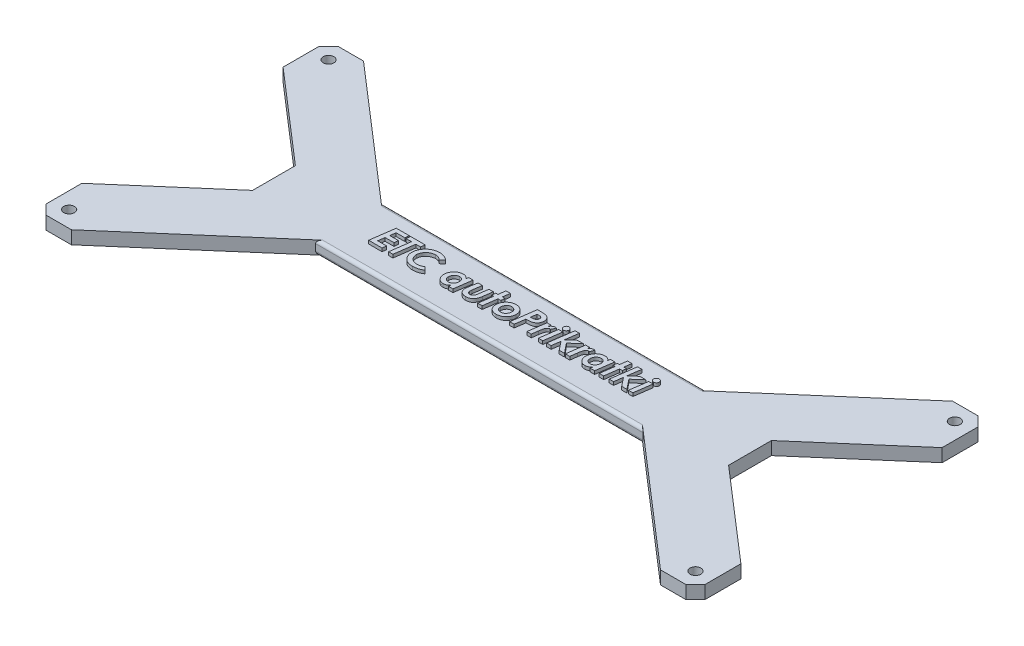
from build123d import *

# Parameters (mm, degrees)
SKETCH1_R           = 1.65
BOSS_EXTRUDE1_DEPTH = 4
BOSS_EXTRUDE2_DEPTH = 1
FILLET1_R           = 1


with BuildPart() as part:
    # Sketch1 → Boss-Extrude1 (new body)
    # profile 1 of 2: a face of its own
    with BuildSketch(Plane(origin=(0, 0, 0), x_dir=(1, 0, 0), z_dir=(0, 1, 0))):
        Polygon((0, 10), (0, -10), (50, -10), (90.01956326, -44.641426316), (97.773936856, -44.641426316), (100.702869044, -41.712494128), (100.702869044, -30.743435286), (72.747301092, -6.544751732), (72.747301092, 6.544751732), (100.702869044, 30.743435286), (100.702869044, 41.712494128), (97.773936856, 44.641426316), (90.01956326, 44.641426316), (50, 10), align=None)
        with Locations(Location((95.702869044, -39.641426316, 0), (0, 0, 270))):
            Circle(SKETCH1_R, mode=Mode.SUBTRACT)
        with Locations(Location((95.702869044, 39.641426316, 0), (0, 0, 270))):
            Circle(SKETCH1_R, mode=Mode.SUBTRACT)
    # profile 2 of 2: a face of its own
    with BuildSketch(Plane(origin=(0, 0, 0), x_dir=(1, 0, 0), z_dir=(0, 1, 0))):
        Polygon((-100.702869044, -30.743435286), (-100.702869044, -41.712494128), (-97.773936856, -44.641426316), (-90.01956326, -44.641426316), (-50, -10), (0, -10), (0, 10), (-50, 10), (-90.01956326, 44.641426316), (-97.773936856, 44.641426316), (-100.702869044, 41.712494128), (-100.702869044, 30.743435286), (-72.747301092, 6.544751732), (-72.747301092, -6.544751732), align=None)
        with Locations(Location((-95.702869044, -39.641426316, 0), (0, 0, 270))):
            Circle(SKETCH1_R, mode=Mode.SUBTRACT)
        with Locations(Location((-95.702869044, 39.641426316, 0), (0, 0, 270))):
            Circle(SKETCH1_R, mode=Mode.SUBTRACT)
    extrude(amount=BOSS_EXTRUDE1_DEPTH)

    # Sketch2 → Boss-Extrude2 (add)
    # profile 1 of 18: a face of its own
    with BuildSketch(Plane(origin=(0, 4, 0), x_dir=(1, 0, 0), z_dir=(0, 1, 0))):
        Polygon((-39.771213942, 4.408333333), (-35.776175214, 4.408333333), (-35.931999533, 3.173611111), (-38.60178953, 3.173611111), (-38.842204193, 1.463995726), (-36.147185497, 1.463995726), (-36.304493857, 0.229273504), (-39.015837006, 0.229273504), (-39.294836739, -1.765277778), (-36.555296808, -1.765277778), (-36.711121127, -3), (-40.810042735, -3), align=None)
    # profile 2 of 18: a face of its own
    with BuildSketch(Plane(origin=(0, 4, 0), x_dir=(1, 0, 0), z_dir=(0, 1, 0))):
        Polygon((-35.396260684, 4.408333333), (-30.932264957, 4.408333333), (-31.0925414, 3.173611111), (-32.53502938, 3.173611111), (-33.391321114, -3), (-34.731410256, -3), (-33.876602564, 3.173611111), (-35.566925414, 3.173611111), align=None)
    # profile 3 of 18: a face of its own
    with BuildSketch(Plane(origin=(0, 4, 0), x_dir=(1, 0, 0), z_dir=(0, 1, 0))):
        with BuildLine():
            Line((-23.79402711, 3.476355502), (-24.819499533, 2.557734041))
            add(Edge.make_bspline(
                [(-24.819499533, 2.557734041), (-24.876407481, 2.620086184), (-24.98999964, 2.744545327), (-25.186822346, 2.904370451), (-25.400073268, 3.04348227), (-25.63072019, 3.158974908), (-25.875271556, 3.251218503), (-26.131628235, 3.31621634), (-26.398268359, 3.355898248), (-26.579434113, 3.360982371), (-26.671582866, 3.363568376)],
                knots=[0, 0, 0, 0, 0.971056601, 1.938295404, 2.910103745, 3.898650509, 4.902833105, 5.914277838, 6.939111328, 8, 8, 8, 8], degree=3))
            add(Edge.make_bspline(
                [(-26.671582866, 3.363568376), (-26.736927778, 3.36254447), (-26.866918827, 3.360507607), (-27.060824218, 3.340473973), (-27.252528939, 3.307554749), (-27.442345152, 3.26300068), (-27.63073036, 3.206945518), (-27.815626073, 3.135056734), (-27.998755299, 3.05144716), (-28.179261883, 2.957425539), (-28.352728039, 2.8510152), (-28.517844342, 2.73671784), (-28.673028959, 2.614912938), (-28.817491352, 2.483633182), (-28.952140004, 2.343787212), (-29.079417358, 2.197548374), (-29.192971729, 2.040379018), (-29.298745976, 1.878102834), (-29.391700967, 1.709081018), (-29.472937414, 1.536934578), (-29.544662435, 1.362891714), (-29.597572089, 1.184235022), (-29.644038608, 1.003997543), (-29.673831242, 0.820179886), (-29.694641334, 0.633906077), (-29.696572065, 0.508826803), (-29.697542735, 0.44594351)],
                knots=[0, 0, 0, 0, 1.01063672, 2.010466049, 3.011934156, 4.018040672, 5.025194429, 6.049901815, 7.084166442, 8.138480354, 9.196343408, 10.230183256, 11.243713301, 12.245999792, 13.247233952, 14.245803109, 15.242258641, 16.244194478, 17.240973215, 18.223430354, 19.188354289, 20.149355445, 21.103383867, 22.065846529, 23.027609163, 24, 24, 24, 24], degree=3))
            add(Edge.make_bspline(
                [(-29.697542735, 0.44594351), (-29.695906406, 0.361713694), (-29.692686925, 0.195991369), (-29.656556235, -0.046797151), (-29.6027796, -0.279278505), (-29.524945333, -0.500678356), (-29.424565133, -0.710510256), (-29.304634424, -0.911254961), (-29.158702456, -1.098087769), (-28.995248001, -1.274456475), (-28.813339237, -1.43349079), (-28.618391937, -1.574673546), (-28.409164688, -1.691626287), (-28.188439911, -1.789360361), (-27.954237879, -1.862966302), (-27.708364354, -1.916096732), (-27.45016546, -1.950032576), (-27.273716941, -1.953475965), (-27.183577057, -1.955235043)],
                knots=[0, 0, 0, 0, 1.037508871, 2.041300697, 3.018951676, 3.975513831, 4.927438979, 5.88223082, 6.851861871, 7.844178858, 8.842305637, 9.825493826, 10.805727671, 11.791408773, 12.796144752, 13.825955475, 14.88937509, 16, 16, 16, 16], degree=3))
            add(Edge.make_bspline(
                [(-27.183577057, -1.955235043), (-27.086557399, -1.953579506), (-26.895603749, -1.950321087), (-26.61445757, -1.922961614), (-26.343228538, -1.878542935), (-26.082111473, -1.81677731), (-25.830845657, -1.735617672), (-25.589368507, -1.638358716), (-25.357393357, -1.522355311), (-25.211587272, -1.431075621), (-25.138568376, -1.385363248)],
                knots=[0, 0, 0, 0, 1.080949117, 2.127519159, 3.144326023, 4.141762213, 5.114520833, 6.083915527, 7.040435296, 8, 8, 8, 8], degree=3))
            Line((-25.138568376, -1.385363248), (-24.306021301, -2.302500668))
            add(Edge.make_bspline(
                [(-24.306021301, -2.302500668), (-24.412286815, -2.373503026), (-24.624235436, -2.5151186), (-24.96050339, -2.695733979), (-25.309380822, -2.847347024), (-25.669592348, -2.972240909), (-26.041988615, -3.070964071), (-26.427116952, -3.139950836), (-26.824941671, -3.182910909), (-27.094424321, -3.187586494), (-27.231066373, -3.189957265)],
                knots=[0, 0, 0, 0, 0.987115275, 1.968820479, 2.944554184, 3.923725951, 4.912076401, 5.918257257, 6.944445583, 8, 8, 8, 8], degree=3))
            add(Edge.make_bspline(
                [(-27.231066373, -3.189957265), (-27.326579867, -3.188480901), (-27.514372054, -3.185578173), (-27.790270637, -3.164273172), (-28.05553042, -3.130936514), (-28.309640805, -3.081554084), (-28.553097807, -3.019593403), (-28.78595887, -2.944064118), (-29.007303301, -2.853004619), (-29.218464758, -2.74959823), (-29.418316633, -2.631164277), (-29.608694989, -2.500863787), (-29.788175531, -2.356355286), (-29.95826823, -2.200201027), (-30.117401377, -2.030476567), (-30.26598075, -1.846995018), (-30.405318147, -1.651257468), (-30.534055296, -1.444282919), (-30.649646994, -1.228154887), (-30.749809799, -1.00571883), (-30.837543489, -0.780002075), (-30.904663438, -0.548101727), (-30.960532833, -0.313085231), (-30.99844473, -0.072449284), (-31.02341294, 0.171853502), (-31.025963384, 0.336557107), (-31.02724359, 0.419230769)],
                knots=[0, 0, 0, 0, 1.169367826, 2.299132101, 3.38621766, 4.441052208, 5.466435492, 6.460518735, 7.435693363, 8.394593391, 9.33676259, 10.277587488, 11.216890426, 12.155626877, 13.10261201, 14.062754619, 15.044266364, 16.042621295, 17.045211417, 18.042739217, 19.028130471, 20.007415779, 20.996189116, 21.983978755, 22.988049715, 24, 24, 24, 24], degree=3))
            add(Edge.make_bspline(
                [(-31.02724359, 0.419230769), (-31.025687458, 0.508353994), (-31.022584602, 0.686061646), (-30.992660926, 0.951246499), (-30.947392339, 1.213639829), (-30.882588781, 1.47323009), (-30.801859185, 1.730114895), (-30.699289737, 1.983202364), (-30.581145405, 2.234638595), (-30.442880031, 2.480647261), (-30.291984873, 2.720172859), (-30.124506199, 2.946639304), (-29.944540302, 3.160226591), (-29.753688143, 3.362944653), (-29.54779556, 3.550294852), (-29.328761867, 3.724230948), (-29.097397481, 3.885959841), (-28.854062157, 4.034175936), (-28.602161976, 4.16740583), (-28.342330811, 4.281621357), (-28.07758032, 4.380449582), (-27.806841171, 4.460383651), (-27.529957591, 4.521163389), (-27.248056659, 4.565770492), (-26.96003137, 4.593203378), (-26.766126043, 4.596588357), (-26.668614784, 4.598290598)],
                knots=[0, 0, 0, 0, 0.95794203, 1.910092795, 2.865876462, 3.819215003, 4.78477586, 5.758651491, 6.753180615, 7.769892659, 8.790977917, 9.795230985, 10.79565955, 11.792688852, 12.786634645, 13.785945562, 14.798181656, 15.819862441, 16.847685968, 17.859754353, 18.869513914, 19.884373831, 20.892254455, 21.915374149, 22.951681752, 24, 24, 24, 24], degree=3))
            add(Edge.make_bspline(
                [(-26.668614784, 4.598290598), (-26.532413822, 4.594825119), (-26.263460168, 4.587981899), (-25.867359044, 4.534959759), (-25.485083229, 4.447563163), (-25.117151488, 4.323316156), (-24.762211581, 4.166010168), (-24.42261631, 3.971542635), (-24.09693314, 3.742523662), (-23.895859801, 3.565837444), (-23.79402711, 3.476355502)],
                knots=[0, 0, 0, 0, 1.033545388, 2.040923972, 3.027343848, 4.005734438, 4.983995331, 5.969464303, 6.971644303, 8, 8, 8, 8], degree=3))
        make_face()
    # profile 4 of 18: a face of its own
    with BuildSketch(Plane(origin=(0, 4, 0), x_dir=(1, 0, 0), z_dir=(0, 1, 0))):
        with BuildLine():
            Line((-15.631800881, 2.413782051), (-14.290227698, 2.413782051))
            Line((-14.290227698, 2.413782051), (-15.058961004, -3))
            Line((-15.058961004, -3), (-16.400534188, -3))
            Line((-16.400534188, -3), (-16.307039597, -2.338117655))
            add(Edge.make_bspline(
                [(-16.307039597, -2.338117655), (-16.3767978, -2.404517982), (-16.50981432, -2.531131627), (-16.715833278, -2.695391946), (-16.914150652, -2.828981498), (-17.109669225, -2.931442959), (-17.307759346, -3.005780404), (-17.513377505, -3.057268876), (-17.73070468, -3.089470654), (-17.879513004, -3.093111775), (-17.955809295, -3.094978632)],
                knots=[0, 0, 0, 0, 1.236324186, 2.357450916, 3.379388742, 4.30284698, 5.185433758, 6.089881904, 7.020653398, 8, 8, 8, 8], degree=3))
            add(Edge.make_bspline(
                [(-17.955809295, -3.094978632), (-18.043017702, -3.092946993), (-18.213810767, -3.088968134), (-18.462950707, -3.050464447), (-18.698476746, -2.990245504), (-18.920499797, -2.905274734), (-19.127820194, -2.794363737), (-19.322422815, -2.659913044), (-19.502547887, -2.50026755), (-19.665725068, -2.317538955), (-19.812885936, -2.120592428), (-19.940886217, -1.91247752), (-20.052031255, -1.698063475), (-20.138540489, -1.473433178), (-20.209953015, -1.242787664), (-20.257759224, -1.003050803), (-20.288597701, -0.755943865), (-20.292622347, -0.588526805), (-20.29465812, -0.503842815)],
                knots=[0, 0, 0, 0, 1.072254913, 2.099954687, 3.093402483, 4.05863531, 5.017013142, 5.979305845, 6.962352722, 7.970695896, 8.988290287, 9.983079422, 10.973839091, 11.95483031, 12.940586347, 13.940815436, 14.958409826, 16, 16, 16, 16], degree=3))
            add(Edge.make_bspline(
                [(-20.29465812, -0.503842815), (-20.293636647, -0.438497408), (-20.291604624, -0.308505374), (-20.271534968, -0.114607312), (-20.238833948, 0.076650357), (-20.193921774, 0.265902297), (-20.137939291, 0.453096619), (-20.067957344, 0.637560559), (-19.984012099, 0.818922692), (-19.889653732, 0.997400114), (-19.785502182, 1.170840222), (-19.668667464, 1.333628842), (-19.546022653, 1.488741044), (-19.413633743, 1.633135499), (-19.271834386, 1.766340825), (-19.123547639, 1.892557415), (-18.963998601, 2.005670403), (-18.798805481, 2.111587543), (-18.627008729, 2.203812315), (-18.453264172, 2.286689478), (-18.276229765, 2.35425155), (-18.098138067, 2.411443266), (-17.917436658, 2.454391557), (-17.735007852, 2.485262944), (-17.55063722, 2.505750612), (-17.427049763, 2.507756298), (-17.365160924, 2.508760684)],
                knots=[0, 0, 0, 0, 1.010861959, 2.01091412, 3.012605424, 4.011485121, 5.018863341, 6.033918867, 7.061452407, 8.109228878, 9.15680961, 10.18900835, 11.207521355, 12.215190347, 13.216881651, 14.216552911, 15.225616441, 16.240671966, 17.251099115, 18.240697123, 19.217272556, 20.180771028, 21.133199006, 22.08832996, 23.042693801, 24, 24, 24, 24], degree=3))
            add(Edge.make_bspline(
                [(-17.365160924, 2.508760684), (-17.282856652, 2.506415814), (-17.120623119, 2.50179374), (-16.883008381, 2.458465319), (-16.655377909, 2.389936588), (-16.438295162, 2.29490488), (-16.234427982, 2.173813461), (-16.049729642, 2.024653892), (-15.880026831, 1.853682677), (-15.787265906, 1.721243011), (-15.740135884, 1.653952991)],
                knots=[0, 0, 0, 0, 1.030509072, 2.031281277, 3.015697838, 4.003854478, 4.993584726, 5.977161716, 6.972235198, 8, 8, 8, 8], degree=3))
            Line((-15.740135884, 1.653952991), (-15.631800881, 2.413782051))
        make_face()
        with BuildLine():
            add(Edge.make_bspline(
                [(-17.657517027, -1.86025641), (-17.580155556, -1.857865279), (-17.429286253, -1.853202126), (-17.211320514, -1.811894144), (-17.008206777, -1.746844709), (-16.820251954, -1.653856402), (-16.646809674, -1.531557478), (-16.489374584, -1.37891922), (-16.347177448, -1.196069227), (-16.222472975, -0.988516416), (-16.118253729, -0.765295188), (-16.041893969, -0.534844175), (-15.993197295, -0.301586622), (-15.987729997, -0.144441486), (-15.985002671, -0.066050681)],
                knots=[0, 0, 0, 0, 1.017901168, 1.985097214, 2.910041334, 3.818973104, 4.735274743, 5.693545178, 6.695670165, 7.777101795, 8.875856117, 9.932619244, 10.968700869, 12, 12, 12, 12], degree=3))
            add(Edge.make_bspline(
                [(-15.985002671, -0.066050681), (-15.986250308, -0.017037192), (-15.98870219, 0.079285085), (-16.004729489, 0.21994386), (-16.032904443, 0.353189526), (-16.073330641, 0.478939768), (-16.124969038, 0.597329823), (-16.188202338, 0.708706764), (-16.262127624, 0.812290736), (-16.347099014, 0.907993263), (-16.44205478, 0.992781722), (-16.542734272, 1.070513624), (-16.653817999, 1.131552493), (-16.769921411, 1.184816317), (-16.894217235, 1.224105488), (-17.025013891, 1.254717817), (-17.163945769, 1.270277357), (-17.258773246, 1.272765582), (-17.30728332, 1.274038462)],
                knots=[0, 0, 0, 0, 1.109141645, 2.179707075, 3.198451464, 4.18615572, 5.163657463, 6.116161664, 7.079133258, 8.038519567, 9.005387219, 9.956904198, 10.909408399, 11.866440704, 12.843493655, 13.853714903, 14.902043453, 16, 16, 16, 16], degree=3))
            add(Edge.make_bspline(
                [(-17.30728332, 1.274038462), (-17.363773345, 1.272805392), (-17.47529198, 1.270371153), (-17.639167277, 1.245230146), (-17.797225455, 1.207691537), (-17.947936187, 1.151516704), (-18.092871967, 1.082280036), (-18.229779144, 0.994804137), (-18.361319503, 0.893443602), (-18.484700261, 0.777236128), (-18.597238889, 0.648656004), (-18.695734232, 0.509945008), (-18.779552694, 0.361894113), (-18.847850719, 0.204734826), (-18.899560681, 0.037793641), (-18.93846921, -0.136772253), (-18.960878796, -0.321217081), (-18.963575885, -0.44689433), (-18.964957265, -0.511263021)],
                knots=[0, 0, 0, 0, 0.994897251, 1.964056203, 2.915642991, 3.853470011, 4.79324038, 5.741466074, 6.711095529, 7.716481674, 8.723680824, 9.71796663, 10.70964959, 11.717112863, 12.731868792, 13.785363818, 14.865719672, 16, 16, 16, 16], degree=3))
            add(Edge.make_bspline(
                [(-18.964957265, -0.511263021), (-18.96368736, -0.560763654), (-18.961203954, -0.657566255), (-18.945587666, -0.799419583), (-18.915176502, -0.933270624), (-18.875242893, -1.059991117), (-18.824865578, -1.179703092), (-18.762119277, -1.291674715), (-18.687415413, -1.396115058), (-18.601829857, -1.49217523), (-18.506527631, -1.577691272), (-18.405532804, -1.654530518), (-18.296678053, -1.71815041), (-18.181449258, -1.770758895), (-18.059424431, -1.810735674), (-17.931036114, -1.83831901), (-17.796580952, -1.857184913), (-17.704579069, -1.859216954), (-17.657517027, -1.86025641)],
                knots=[0, 0, 0, 0, 1.124431694, 2.198919568, 3.234766021, 4.236791382, 5.213425507, 6.179206721, 7.145706547, 8.12447102, 9.094881178, 10.04988442, 11.001776355, 11.952075609, 12.922030374, 13.911569148, 14.931697721, 16, 16, 16, 16], degree=3))
        make_face(mode=Mode.SUBTRACT)
    # profile 5 of 18: a face of its own
    with BuildSketch(Plane(origin=(0, 4, 0), x_dir=(1, 0, 0), z_dir=(0, 1, 0))):
        with BuildLine():
            Line((-12.792830195, 2.413782051), (-11.451257011, 2.413782051))
            Line((-11.451257011, 2.413782051), (-11.846011952, -0.334662126))
            add(Edge.make_bspline(
                [(-11.846011952, -0.334662126), (-11.85517241, -0.405863674), (-11.872265806, -0.538725619), (-11.892285446, -0.723689151), (-11.902907773, -0.880671786), (-11.905626713, -0.97575758), (-11.906857639, -1.018805088)],
                knots=[0, 0, 0, 0, 1.253526504, 2.339077935, 3.248062684, 4, 4, 4, 4], degree=3))
            add(Edge.make_bspline(
                [(-11.906857639, -1.018805088), (-11.904468498, -1.076086334), (-11.899787682, -1.18831206), (-11.849247524, -1.347779577), (-11.772675564, -1.494660652), (-11.664075632, -1.622249934), (-11.531718332, -1.729072989), (-11.377121942, -1.805147159), (-11.204764624, -1.853027366), (-11.083542568, -1.857793093), (-11.020885083, -1.86025641)],
                knots=[0, 0, 0, 0, 1.002835694, 1.964761131, 2.909147679, 3.895784594, 4.884866332, 5.875587295, 6.90192956, 8, 8, 8, 8], degree=3))
            add(Edge.make_bspline(
                [(-11.020885083, -1.86025641), (-10.979781535, -1.859554891), (-10.899759813, -1.858189152), (-10.783393802, -1.843168127), (-10.674655916, -1.817833153), (-10.573176943, -1.783711131), (-10.478676165, -1.740750813), (-10.391812616, -1.686958443), (-10.313257104, -1.622459077), (-10.239132201, -1.54832536), (-10.173740996, -1.456453922), (-10.111049684, -1.348094121), (-10.055736003, -1.218428414), (-10.001768544, -1.070196924), (-9.955639637, -0.900610146), (-9.912550359, -0.711493818), (-9.874246899, -0.50249978), (-9.853406326, -0.356014798), (-9.842556424, -0.279752604)],
                knots=[0, 0, 0, 0, 0.892108868, 1.736786517, 2.541881516, 3.312938247, 4.057891121, 4.791136306, 5.524224126, 6.261001152, 7.060198994, 7.964829526, 8.974738879, 10.116351085, 11.388184609, 12.787440625, 14.327495265, 16, 16, 16, 16], degree=3))
            Line((-9.842556424, -0.279752604), (-9.45818977, 2.413782051))
            Line((-9.45818977, 2.413782051), (-8.115132545, 2.413782051))
            Line((-8.115132545, 2.413782051), (-8.529180021, -0.48455028))
            add(Edge.make_bspline(
                [(-8.529180021, -0.48455028), (-8.54098436, -0.563296158), (-8.563993425, -0.716787934), (-8.606996582, -0.939599982), (-8.656456728, -1.148733602), (-8.708275056, -1.34511558), (-8.770380897, -1.52618225), (-8.834413321, -1.695088554), (-8.907827944, -1.849059911), (-9.008839932, -2.035727205), (-9.154760639, -2.244718209), (-9.355267873, -2.467740078), (-9.583578494, -2.658678089), (-9.838151615, -2.816622519), (-10.116596687, -2.942995365), (-10.419960627, -3.030785694), (-10.746331257, -3.085634196), (-10.9716848, -3.091803495), (-11.087666934, -3.094978632)],
                knots=[0, 0, 0, 0, 0.938282912, 1.828904783, 2.673080473, 3.47068305, 4.220973376, 4.927886656, 5.59807994, 6.229421123, 7.427669869, 8.591533972, 9.754419504, 10.92230609, 12.112044702, 13.346047806, 14.63409719, 16, 16, 16, 16], degree=3))
            add(Edge.make_bspline(
                [(-11.087666934, -3.094978632), (-11.169864207, -3.093376064), (-11.330260478, -3.09024888), (-11.564519776, -3.062742152), (-11.785791222, -3.01931032), (-11.993556456, -2.95590713), (-12.189747241, -2.877888345), (-12.371954701, -2.77959091), (-12.542055512, -2.664301172), (-12.696613325, -2.531134048), (-12.83606792, -2.384253515), (-12.958666898, -2.226624664), (-13.061778648, -2.057896373), (-13.145093368, -1.878411186), (-13.210287597, -1.689349531), (-13.258302051, -1.490229518), (-13.286893103, -1.280339118), (-13.289922711, -1.13662847), (-13.291468015, -1.063326322)],
                knots=[0, 0, 0, 0, 1.168632583, 2.280420012, 3.349725486, 4.371307417, 5.365511249, 6.347568045, 7.309587773, 8.282530155, 9.242979364, 10.185822766, 11.117310968, 12.048958566, 12.994554036, 13.956959565, 14.957911239, 16, 16, 16, 16], degree=3))
            add(Edge.make_bspline(
                [(-13.291468015, -1.063326322), (-13.290611556, -1.015340428), (-13.288845168, -0.916372868), (-13.283474477, -0.762893737), (-13.270868455, -0.599664101), (-13.254448686, -0.426022132), (-13.234298414, -0.242308549), (-13.206169244, -0.049191581), (-13.177859578, 0.154001058), (-13.153857916, 0.292161307), (-13.141579861, 0.362837206)],
                knots=[0, 0, 0, 0, 0.80233306, 1.654755999, 2.566827454, 3.538651181, 4.570611162, 5.655930814, 6.800891005, 8, 8, 8, 8], degree=3))
            Line((-13.141579861, 0.362837206), (-12.792830195, 2.413782051))
        make_face()
    # profile 6 of 18: a face of its own
    with BuildSketch(Plane(origin=(0, 4, 0), x_dir=(1, 0, 0), z_dir=(0, 1, 0))):
        Polygon((-6.418873531, 4.598290598), (-5.078784388, 4.598290598), (-5.381528779, 2.413782051), (-4.534141293, 2.413782051), (-4.694417735, 1.274038462), (-5.540321181, 1.274038462), (-6.132453592, -3), (-7.472542735, -3), (-6.880410323, 1.274038462), (-7.536356504, 1.274038462), (-7.382016226, 2.413782051), (-6.721617922, 2.413782051), align=None)
    # profile 7 of 18: a face of its own
    with BuildSketch(Plane(origin=(0, 4, 0), x_dir=(1, 0, 0), z_dir=(0, 1, 0))):
        with BuildLine():
            add(Edge.make_bspline(
                [(-1.215825321, 2.508760684), (-1.155921969, 2.508208528), (-1.03736522, 2.507115738), (-0.86160791, 2.489178261), (-0.689502349, 2.46485436), (-0.521875247, 2.429286064), (-0.358874749, 2.382813875), (-0.199810805, 2.326203904), (-0.044290303, 2.260026162), (0.105534973, 2.182376254), (0.249533212, 2.096560175), (0.38638478, 2.001915788), (0.513810553, 1.897078145), (0.635383688, 1.786136534), (0.745982597, 1.664059846), (0.848613821, 1.534323318), (0.944517948, 1.397000306), (1.031435869, 1.251244799), (1.10797829, 1.09794926), (1.177100328, 0.941047495), (1.233578197, 0.7781215), (1.278556237, 0.610725743), (1.317303133, 0.439239602), (1.34069961, 0.262885063), (1.358918086, 0.082236703), (1.359947828, -0.039782676), (1.360470085, -0.101667668)],
                knots=[0, 0, 0, 0, 1.048380346, 2.074885017, 3.090367486, 4.090964834, 5.072523792, 6.056029873, 7.045505985, 8.029469653, 9.008388104, 9.979110116, 10.939576094, 11.895736256, 12.858269977, 13.820062943, 14.790784955, 15.789017664, 16.788414625, 17.789274365, 18.789121639, 19.804049856, 20.823403653, 21.864603227, 22.916983403, 24, 24, 24, 24], degree=3))
            add(Edge.make_bspline(
                [(1.360470085, -0.101667668), (1.357437506, -0.203704076), (1.351464579, -0.404673597), (1.309585453, -0.700315364), (1.238011038, -0.983731182), (1.137810107, -1.255740957), (1.009637454, -1.516415738), (0.852961015, -1.765989133), (0.665952093, -2.001860605), (0.455100485, -2.224577019), (0.223732363, -2.42860321), (-0.024354719, -2.607065681), (-0.285975769, -2.757929902), (-0.560478517, -2.882401605), (-0.849863873, -2.977017043), (-1.15198606, -3.044783368), (-1.467352402, -3.08814412), (-1.682164848, -3.092671486), (-1.79163328, -3.094978632)],
                knots=[0, 0, 0, 0, 1.011104245, 1.991457176, 2.952197104, 3.902991464, 4.858928698, 5.826026836, 6.817568841, 7.837123857, 8.861887107, 9.870051414, 10.860623363, 11.850212162, 12.851715058, 13.872153699, 14.915649431, 16, 16, 16, 16], degree=3))
            add(Edge.make_bspline(
                [(-1.79163328, -3.094978632), (-1.88622503, -3.093237668), (-2.071055225, -3.089835862), (-2.340558096, -3.055892579), (-2.595794318, -3.003657965), (-2.83605884, -2.926999327), (-3.062308455, -2.831218149), (-3.27361908, -2.712552257), (-3.470528769, -2.573215972), (-3.64903777, -2.410727812), (-3.8115363, -2.233027296), (-3.952387721, -2.039686134), (-4.072854067, -1.833253209), (-4.168563075, -1.612583273), (-4.244821934, -1.379597858), (-4.299576006, -1.133676206), (-4.332931295, -0.874291356), (-4.336450322, -0.696869737), (-4.338247863, -0.606241653)],
                knots=[0, 0, 0, 0, 1.130534475, 2.209039425, 3.242686211, 4.241648197, 5.219495055, 6.175504508, 7.134035888, 8.097337106, 9.056251676, 10.008649417, 10.952170628, 11.908308165, 12.879116703, 13.879338768, 14.916752852, 16, 16, 16, 16], degree=3))
            add(Edge.make_bspline(
                [(-4.338247863, -0.606241653), (-4.335316767, -0.49678692), (-4.329550657, -0.281465397), (-4.286435348, 0.03457729), (-4.211741365, 0.335720952), (-4.108566761, 0.622504415), (-3.978272887, 0.896278228), (-3.814264225, 1.153570206), (-3.623973769, 1.39857346), (-3.404974947, 1.624535916), (-3.167844887, 1.830668018), (-2.91894582, 2.013010946), (-2.65800731, 2.164674737), (-2.389399121, 2.292766189), (-2.108599945, 2.388468817), (-1.819667169, 2.458743752), (-1.520848697, 2.501649469), (-1.31836503, 2.506370107), (-1.215825321, 2.508760684)],
                knots=[0, 0, 0, 0, 1.070407058, 2.105725986, 3.11260329, 4.099768105, 5.082273654, 6.071629737, 7.078227986, 8.111679688, 9.144009435, 10.148605521, 11.124500349, 12.092034995, 13.054511379, 14.020338642, 14.997480131, 16, 16, 16, 16], degree=3))
        make_face()
        with BuildLine():
            add(Edge.make_bspline(
                [(-1.313772035, 1.274038462), (-1.38015258, 1.272424057), (-1.509521237, 1.269277754), (-1.697584111, 1.242057457), (-1.873806966, 1.197713921), (-2.038851803, 1.135633825), (-2.190519864, 1.052806841), (-2.332149644, 0.954598618), (-2.459628187, 0.836145174), (-2.574497555, 0.702982308), (-2.675749972, 0.559386553), (-2.764733303, 0.411654975), (-2.840048657, 0.260382986), (-2.899919979, 0.105953235), (-2.950530059, -0.050624394), (-2.984157386, -0.210787919), (-3.00365505, -0.374248122), (-3.006904936, -0.484003568), (-3.008547009, -0.539459802)],
                knots=[0, 0, 0, 0, 1.147646984, 2.236642535, 3.278363253, 4.285788599, 5.277283386, 6.259990092, 7.25913394, 8.278119336, 9.296601724, 10.294389209, 11.258634566, 12.215104854, 13.156804447, 14.101569642, 15.040778374, 16, 16, 16, 16], degree=3))
            add(Edge.make_bspline(
                [(-3.008547009, -0.539459802), (-3.007313247, -0.587978147), (-3.00490149, -0.682821792), (-2.988807255, -0.8215315), (-2.960230158, -0.952494423), (-2.922148481, -1.076663222), (-2.870925491, -1.193371852), (-2.809118402, -1.303069771), (-2.734933613, -1.404674932), (-2.652902307, -1.500050011), (-2.558824526, -1.584101012), (-2.458131527, -1.658441295), (-2.350064578, -1.722059733), (-2.233497292, -1.771826487), (-2.110018843, -1.812460381), (-1.979151506, -1.840216134), (-1.841031703, -1.856740841), (-1.746664585, -1.859062537), (-1.698138689, -1.86025641)],
                knots=[0, 0, 0, 0, 1.110133544, 2.170088686, 3.189065258, 4.17351184, 5.136579884, 6.099647928, 7.048308506, 8.010844321, 8.972448026, 9.927769731, 10.871216919, 11.834284962, 12.822174017, 13.841150589, 14.889866456, 16, 16, 16, 16], degree=3))
            add(Edge.make_bspline(
                [(-1.698138689, -1.86025641), (-1.629797401, -1.858496409), (-1.496589791, -1.855065899), (-1.303077382, -1.829917401), (-1.122302632, -1.787212392), (-0.9543182, -1.726071697), (-0.799300264, -1.6466474), (-0.655342615, -1.551748726), (-0.52570715, -1.437416989), (-0.408977049, -1.308423837), (-0.306408798, -1.168335222), (-0.216867179, -1.021480586), (-0.139245566, -0.870667173), (-0.07661943, -0.714159881), (-0.02924048, -0.553017796), (0.005007466, -0.387261927), (0.026264006, -0.216488139), (0.029257862, -0.10073892), (0.030769231, -0.042306023)],
                knots=[0, 0, 0, 0, 1.164111062, 2.269030304, 3.317651816, 4.322802953, 5.30652745, 6.278887004, 7.252451034, 8.242831511, 9.237327035, 10.205734188, 11.170614506, 12.123681709, 13.072978069, 14.028315502, 15.004647829, 16, 16, 16, 16], degree=3))
            add(Edge.make_bspline(
                [(0.030769231, -0.042306023), (0.029654594, 0.005235886), (0.02746365, 0.098684893), (0.009487569, 0.235406498), (-0.020550259, 0.3648467), (-0.060059314, 0.488329359), (-0.114333119, 0.603532051), (-0.177740719, 0.713604605), (-0.256342864, 0.814154201), (-0.343217564, 0.908972866), (-0.439195197, 0.995168865), (-0.544180762, 1.069466637), (-0.654932034, 1.133885444), (-0.773959433, 1.184260567), (-0.899155145, 1.224286915), (-1.031065339, 1.25451487), (-1.170422929, 1.270317131), (-1.26525805, 1.272779043), (-1.313772035, 1.274038462)],
                knots=[0, 0, 0, 0, 1.079193067, 2.121276228, 3.123935011, 4.093589047, 5.058482656, 6.010079462, 6.971567708, 7.949254825, 8.927715837, 9.893916005, 10.864935156, 11.830939453, 12.821955205, 13.846519011, 14.898362312, 16, 16, 16, 16], degree=3))
        make_face(mode=Mode.SUBTRACT)
    # profile 8 of 18: a face of its own
    with BuildSketch(Plane(origin=(0, 4, 0), x_dir=(1, 0, 0), z_dir=(0, 1, 0))):
        with BuildLine():
            Line((3.349085203, 4.408333333), (4.61645633, 4.408333333))
            add(Edge.make_bspline(
                [(4.61645633, 4.408333333), (4.708974201, 4.407956531), (4.887148608, 4.407230872), (5.143968586, 4.396352243), (5.380084768, 4.38056952), (5.594914294, 4.358466311), (5.788414203, 4.331558563), (5.960017865, 4.295028313), (6.11188674, 4.256078866), (6.203199302, 4.219275538), (6.245933494, 4.202051616)],
                knots=[0, 0, 0, 0, 1.344208059, 2.588726621, 3.734329264, 4.782131975, 5.726482068, 6.570895881, 7.331180631, 8, 8, 8, 8], degree=3))
            add(Edge.make_bspline(
                [(6.245933494, 4.202051616), (6.293757118, 4.180473016), (6.388020822, 4.137940088), (6.521206425, 4.063538276), (6.645199285, 3.982604201), (6.761164195, 3.896926023), (6.868252649, 3.804622801), (6.967087669, 3.706437492), (7.055902321, 3.600775621), (7.136454309, 3.489255066), (7.207331135, 3.371856042), (7.270305552, 3.250267346), (7.321840386, 3.123307386), (7.365754587, 2.992233572), (7.39789856, 2.854989123), (7.421205662, 2.713179907), (7.437101028, 2.566501168), (7.438427591, 2.467250323), (7.439102564, 2.416750134)],
                knots=[0, 0, 0, 0, 1.101151138, 2.170445781, 3.198860437, 4.208379212, 5.195204417, 6.164605257, 7.130047863, 8.089887807, 9.049952485, 10.006809717, 10.961522665, 11.923831799, 12.906274987, 13.917075149, 14.940179313, 16, 16, 16, 16], degree=3))
            add(Edge.make_bspline(
                [(7.439102564, 2.416750134), (7.437833751, 2.361310743), (7.435313366, 2.251185248), (7.419105132, 2.088406095), (7.390777169, 1.929626945), (7.35007739, 1.775171926), (7.300328023, 1.623424475), (7.237236044, 1.47654517), (7.164813679, 1.333166003), (7.079693836, 1.196092187), (6.987556425, 1.063996985), (6.884314877, 0.942218591), (6.774294774, 0.829668078), (6.658076308, 0.72388161), (6.531742575, 0.630334325), (6.399720791, 0.54314454), (6.25887862, 0.467477077), (6.10858512, 0.399294714), (5.940740347, 0.340507286), (5.751233475, 0.289410959), (5.536141625, 0.245072871), (5.296319757, 0.208861177), (5.030970904, 0.179194266), (4.740837746, 0.158093424), (4.42518965, 0.141020424), (4.206389996, 0.136596043), (4.09258981, 0.134294872)],
                knots=[0, 0, 0, 0, 0.866399648, 1.721027061, 2.553550129, 3.384204618, 4.21539855, 5.04677222, 5.880012857, 6.723270778, 7.566245156, 8.394738354, 9.214784533, 10.025005932, 10.847562629, 11.668810448, 12.495570546, 13.343317016, 14.245569203, 15.271435576, 16.408570332, 17.675782105, 19.060520395, 20.580184572, 22.221315141, 24, 24, 24, 24], degree=3))
            Line((4.09258981, 0.134294872), (3.651829594, -3))
            Line((3.651829594, -3), (2.31025641, -3))
            Line((2.31025641, -3), (3.349085203, 4.408333333))
        make_face()
        with BuildLine():
            add(Edge.make_bspline(
                [(4.264738582, 1.369017094), (4.356262093, 1.370573249), (4.530479542, 1.373535432), (4.779583993, 1.384343919), (5.003841198, 1.405260719), (5.203669308, 1.432337516), (5.378677187, 1.467932463), (5.529466899, 1.509322601), (5.654791672, 1.561167209), (5.758552038, 1.619603094), (5.840891805, 1.689182954), (5.913869397, 1.76212163), (5.974890092, 1.844067224), (6.023922876, 1.934283035), (6.063138017, 2.031208889), (6.089352949, 2.136630773), (6.105844104, 2.249028588), (6.108199288, 2.326659082), (6.109401709, 2.366292735)],
                knots=[0, 0, 0, 0, 1.839895187, 3.502289619, 5.0101303, 6.365671836, 7.553232357, 8.598057788, 9.502875839, 10.27370316, 10.980290013, 11.662314044, 12.34441055, 13.025273935, 13.721358838, 14.440015487, 15.203561875, 16, 16, 16, 16], degree=3))
            add(Edge.make_bspline(
                [(6.109401709, 2.366292735), (6.107601018, 2.41041882), (6.104090049, 2.496455368), (6.079576298, 2.620154629), (6.034926485, 2.732334659), (5.97618375, 2.834065607), (5.898983514, 2.922911268), (5.805741526, 2.998113914), (5.695484208, 3.05771842), (5.590605255, 3.094456654), (5.493160925, 3.117906312), (5.401745276, 3.131794598), (5.294420125, 3.145358016), (5.170573899, 3.154936639), (5.031105505, 3.164255827), (4.874721277, 3.169899163), (4.702044878, 3.172426432), (4.58133477, 3.173205589), (4.518509615, 3.173611111)],
                knots=[0, 0, 0, 0, 1.03742853, 2.022766538, 2.947121861, 3.864647693, 4.771646501, 5.697975149, 6.666071958, 7.703435297, 8.301453266, 9.020359131, 9.87578453, 10.844509861, 11.939964187, 13.162010635, 14.522931311, 16, 16, 16, 16], degree=3))
            Line((4.518509615, 3.173611111), (4.264738582, 1.369017094))
        make_face(mode=Mode.SUBTRACT)
    # profile 9 of 18: a face of its own
    with BuildSketch(Plane(origin=(0, 4, 0), x_dir=(1, 0, 0), z_dir=(0, 1, 0))):
        with BuildLine():
            Line((8.302814503, 2.413782051), (9.549409054, 2.413782051))
            Line((9.549409054, 2.413782051), (9.452946381, 1.653952991))
            add(Edge.make_bspline(
                [(9.452946381, 1.653952991), (9.497743924, 1.721600093), (9.584072739, 1.851962022), (9.72875452, 2.027002803), (9.880414046, 2.174970441), (10.038680258, 2.297226632), (10.20456082, 2.391726266), (10.377348756, 2.459499382), (10.557076243, 2.501182006), (10.679535924, 2.506225443), (10.741094084, 2.508760684)],
                knots=[0, 0, 0, 0, 1.203274242, 2.318815539, 3.362160423, 4.341361458, 5.27818761, 6.184615762, 7.087440759, 8, 8, 8, 8], degree=3))
            add(Edge.make_bspline(
                [(10.741094084, 2.508760684), (10.771352953, 2.507563731), (10.833356468, 2.505111052), (10.92693753, 2.486226701), (11.022623501, 2.456750163), (11.084686811, 2.428360316), (11.11655649, 2.413782051)],
                knots=[0, 0, 0, 0, 0.929430428, 1.904497954, 2.92395396, 4, 4, 4, 4], degree=3))
            Line((11.11655649, 2.413782051), (10.591205929, 1.208740652))
            add(Edge.make_bspline(
                [(10.591205929, 1.208740652), (10.567040679, 1.218332148), (10.522518724, 1.23600348), (10.45999796, 1.257697405), (10.407153227, 1.270079067), (10.375070633, 1.272842119), (10.361179554, 1.274038462)],
                knots=[0, 0, 0, 0, 1.298729578, 2.392773935, 3.304105365, 4, 4, 4, 4], degree=3))
            add(Edge.make_bspline(
                [(10.361179554, 1.274038462), (10.327917219, 1.272573296), (10.262220787, 1.269679449), (10.165413135, 1.247560076), (10.070912408, 1.213259481), (9.978614245, 1.164296423), (9.890774073, 1.098644517), (9.804490488, 1.021486766), (9.721024738, 0.930006503), (9.639599628, 0.822916399), (9.560601037, 0.694855828), (9.491036468, 0.538360375), (9.423203478, 0.355334932), (9.357494009, 0.144102446), (9.299967615, -0.096800699), (9.243287755, -0.365377956), (9.191609319, -0.662410997), (9.16244462, -0.870308178), (9.147233908, -0.978735978)],
                knots=[0, 0, 0, 0, 0.576935763, 1.139505725, 1.715418098, 2.31853603, 2.945453378, 3.61436612, 4.325438415, 5.091425351, 5.947081821, 6.930670679, 8.058330957, 9.334895625, 10.767784451, 12.355934311, 14.099454639, 16, 16, 16, 16], degree=3))
            Line((9.147233908, -0.978735978), (8.87565438, -3))
            Line((8.87565438, -3), (7.534081197, -3))
            Line((7.534081197, -3), (8.302814503, 2.413782051))
        make_face()
    # profile 10 of 18: a face of its own
    with BuildSketch(Plane(origin=(0, 4, 0), x_dir=(1, 0, 0), z_dir=(0, 1, 0))):
        with BuildLine():
            add(Edge.make_bspline(
                [(12.757905983, 4.693269231), (12.814578641, 4.689964524), (12.925900376, 4.68347311), (13.087332327, 4.63683866), (13.233065104, 4.553426545), (13.364233747, 4.444789302), (13.47287099, 4.313620659), (13.556283104, 4.167887882), (13.602917554, 4.006455932), (13.609408968, 3.895134196), (13.612713675, 3.838461538)],
                knots=[0, 0, 0, 0, 1.014134371, 1.992057583, 2.975098753, 4, 5.024901247, 6.007942417, 6.985865629, 8, 8, 8, 8], degree=3))
            add(Edge.make_bspline(
                [(13.612713675, 3.838461538), (13.609431501, 3.781776075), (13.602984348, 3.670429187), (13.555904201, 3.508761211), (13.473383425, 3.362002945), (13.364106675, 3.230804692), (13.233513366, 3.121709029), (13.086877588, 3.040414281), (12.92595844, 2.993346482), (12.814598229, 2.986923643), (12.757905983, 2.983653846)],
                knots=[0, 0, 0, 0, 1.013694729, 1.991193998, 2.981551723, 4.006008661, 5.030465598, 6.008806002, 6.986305271, 8, 8, 8, 8], degree=3))
            add(Edge.make_bspline(
                [(12.757905983, 2.983653846), (12.701201228, 2.986901278), (12.589816446, 2.993280188), (12.428655664, 3.040792638), (12.281003981, 3.121197043), (12.150374502, 3.230930057), (12.040641488, 3.361559536), (11.960237082, 3.50921122), (11.912724632, 3.670372001), (11.906345723, 3.781756784), (11.903098291, 3.838461538)],
                knots=[0, 0, 0, 0, 1.01324697, 1.990314468, 2.975995575, 4, 5.024004425, 6.009685532, 6.98675303, 8, 8, 8, 8], degree=3))
            add(Edge.make_bspline(
                [(11.903098291, 3.838461538), (11.906368087, 3.895153784), (11.912790927, 4.006513996), (11.959858726, 4.167433144), (12.041153473, 4.314068921), (12.150249136, 4.444662231), (12.281447389, 4.553938981), (12.428205655, 4.636459757), (12.589873631, 4.683539904), (12.70122052, 4.689987057), (12.757905983, 4.693269231)],
                knots=[0, 0, 0, 0, 1.013694729, 1.991193998, 2.969534402, 3.993991339, 5.018448277, 6.008806002, 6.986305271, 8, 8, 8, 8], degree=3))
        make_face()
    # profile 11 of 18: a face of its own
    with BuildSketch(Plane(origin=(0, 4, 0), x_dir=(1, 0, 0), z_dir=(0, 1, 0))):
        Polygon((11.817023905, 2.413782051), (13.158597089, 2.413782051), (12.389863782, -3), (11.048290598, -3), align=None)
    # profile 12 of 18: a face of its own
    with BuildSketch(Plane(origin=(0, 4, 0), x_dir=(1, 0, 0), z_dir=(0, 1, 0))):
        Polygon((14.678255208, 4.598290598), (16.019828392, 4.598290598), (15.449956597, 0.532017895), (17.5498748, 2.413782051), (19.382665598, 2.413782051), (16.628285256, -0.003720954), (19.036884014, -3), (17.434119591, -3), (15.325297142, -0.342082332), (14.954286859, -3), (13.612713675, -3), align=None)
    # profile 13 of 18: a face of its own
    with BuildSketch(Plane(origin=(0, 4, 0), x_dir=(1, 0, 0), z_dir=(0, 1, 0))):
        with BuildLine():
            Line((20.080164931, 2.413782051), (21.326759482, 2.413782051))
            Line((21.326759482, 2.413782051), (21.230296808, 1.653952991))
            add(Edge.make_bspline(
                [(21.230296808, 1.653952991), (21.275094352, 1.721600093), (21.361423167, 1.851962022), (21.506104947, 2.027002803), (21.657764473, 2.174970441), (21.816030686, 2.297226632), (21.981911247, 2.391726266), (22.154699184, 2.459499382), (22.33442667, 2.501182006), (22.456886351, 2.506225443), (22.518444511, 2.508760684)],
                knots=[0, 0, 0, 0, 1.203274242, 2.318815539, 3.362160423, 4.341361458, 5.27818761, 6.184615762, 7.087440759, 8, 8, 8, 8], degree=3))
            add(Edge.make_bspline(
                [(22.518444511, 2.508760684), (22.54870338, 2.507563731), (22.610706895, 2.505111052), (22.704287957, 2.486226701), (22.799973928, 2.456750163), (22.862037238, 2.428360316), (22.893906918, 2.413782051)],
                knots=[0, 0, 0, 0, 0.929430428, 1.904497954, 2.92395396, 4, 4, 4, 4], degree=3))
            Line((22.893906918, 2.413782051), (22.368556357, 1.208740652))
            add(Edge.make_bspline(
                [(22.368556357, 1.208740652), (22.344391107, 1.218332148), (22.299869151, 1.23600348), (22.237348387, 1.257697405), (22.184503654, 1.270079067), (22.152421061, 1.272842119), (22.138529981, 1.274038462)],
                knots=[0, 0, 0, 0, 1.298729578, 2.392773935, 3.304105365, 4, 4, 4, 4], degree=3))
            add(Edge.make_bspline(
                [(22.138529981, 1.274038462), (22.105267646, 1.272573296), (22.039571215, 1.269679449), (21.942763562, 1.247560076), (21.848262836, 1.213259481), (21.755964673, 1.164296423), (21.668124501, 1.098644517), (21.581840916, 1.021486766), (21.498375166, 0.930006503), (21.416950055, 0.822916399), (21.337951464, 0.694855828), (21.268386896, 0.538360375), (21.200553905, 0.355334932), (21.134844436, 0.144102446), (21.077318042, -0.096800699), (21.020638182, -0.365377956), (20.968959747, -0.662410997), (20.939795047, -0.870308178), (20.924584335, -0.978735978)],
                knots=[0, 0, 0, 0, 0.576935763, 1.139505725, 1.715418098, 2.31853603, 2.945453378, 3.61436612, 4.325438415, 5.091425351, 5.947081821, 6.930670679, 8.058330957, 9.334895625, 10.767784451, 12.355934311, 14.099454639, 16, 16, 16, 16], degree=3))
            Line((20.924584335, -0.978735978), (20.653004808, -3))
            Line((20.653004808, -3), (19.311431624, -3))
            Line((19.311431624, -3), (20.080164931, 2.413782051))
        make_face()
    # profile 14 of 18: a face of its own
    with BuildSketch(Plane(origin=(0, 4, 0), x_dir=(1, 0, 0), z_dir=(0, 1, 0))):
        with BuildLine():
            Line((27.678455529, 2.413782051), (29.020028713, 2.413782051))
            Line((29.020028713, 2.413782051), (28.251295406, -3))
            Line((28.251295406, -3), (26.909722222, -3))
            Line((26.909722222, -3), (27.003216814, -2.338117655))
            add(Edge.make_bspline(
                [(27.003216814, -2.338117655), (26.93345861, -2.404517982), (26.800442091, -2.531131627), (26.594423132, -2.695391946), (26.396105758, -2.828981498), (26.200587185, -2.931442959), (26.002497065, -3.005780404), (25.796878905, -3.057268876), (25.57955173, -3.089470654), (25.430743406, -3.093111775), (25.354447115, -3.094978632)],
                knots=[0, 0, 0, 0, 1.236324186, 2.357450916, 3.379388742, 4.30284698, 5.185433758, 6.089881904, 7.020653398, 8, 8, 8, 8], degree=3))
            add(Edge.make_bspline(
                [(25.354447115, -3.094978632), (25.267238708, -3.092946993), (25.096445643, -3.088968134), (24.847305703, -3.050464447), (24.611779664, -2.990245504), (24.389756613, -2.905274734), (24.182436216, -2.794363737), (23.987833596, -2.659913044), (23.807708524, -2.50026755), (23.644531342, -2.317538955), (23.497370474, -2.120592428), (23.369370193, -1.91247752), (23.258225155, -1.698063475), (23.171715921, -1.473433178), (23.100303395, -1.242787664), (23.052497186, -1.003050803), (23.02165871, -0.755943865), (23.017634063, -0.588526805), (23.015598291, -0.503842815)],
                knots=[0, 0, 0, 0, 1.072254913, 2.099954687, 3.093402483, 4.05863531, 5.017013142, 5.979305845, 6.962352722, 7.970695896, 8.988290287, 9.983079422, 10.973839091, 11.95483031, 12.940586347, 13.940815436, 14.958409826, 16, 16, 16, 16], degree=3))
            add(Edge.make_bspline(
                [(23.015598291, -0.503842815), (23.016619764, -0.438497408), (23.018651786, -0.308505374), (23.038721442, -0.114607312), (23.071422462, 0.076650357), (23.116334636, 0.265902297), (23.172317119, 0.453096619), (23.242299066, 0.637560559), (23.326244311, 0.818922692), (23.420602678, 0.997400114), (23.524754228, 1.170840222), (23.641588947, 1.333628842), (23.764233757, 1.488741044), (23.896622668, 1.633135499), (24.038422024, 1.766340825), (24.186708771, 1.892557415), (24.346257809, 2.005670403), (24.511450929, 2.111587543), (24.683247681, 2.203812315), (24.856992238, 2.286689478), (25.034026645, 2.35425155), (25.212118343, 2.411443266), (25.392819752, 2.454391557), (25.575248558, 2.485262944), (25.75961919, 2.505750612), (25.883206647, 2.507756298), (25.945095486, 2.508760684)],
                knots=[0, 0, 0, 0, 1.010861959, 2.01091412, 3.012605424, 4.011485121, 5.018863341, 6.033918867, 7.061452407, 8.109228878, 9.15680961, 10.18900835, 11.207521355, 12.215190347, 13.216881651, 14.216552911, 15.225616441, 16.240671966, 17.251099115, 18.240697123, 19.217272556, 20.180771028, 21.133199006, 22.08832996, 23.042693801, 24, 24, 24, 24], degree=3))
            add(Edge.make_bspline(
                [(25.945095486, 2.508760684), (26.027399759, 2.506415814), (26.189633291, 2.50179374), (26.427248029, 2.458465319), (26.654878501, 2.389936588), (26.871961248, 2.29490488), (27.075828428, 2.173813461), (27.260526768, 2.024653892), (27.430229579, 1.853682677), (27.522990504, 1.721243011), (27.570120526, 1.653952991)],
                knots=[0, 0, 0, 0, 1.030509072, 2.031281277, 3.015697838, 4.003854478, 4.993584726, 5.977161716, 6.972235198, 8, 8, 8, 8], degree=3))
            Line((27.570120526, 1.653952991), (27.678455529, 2.413782051))
        make_face()
        with BuildLine():
            add(Edge.make_bspline(
                [(25.652739383, -1.86025641), (25.730100854, -1.857865279), (25.880970157, -1.853202126), (26.098935896, -1.811894144), (26.302049633, -1.746844709), (26.490004456, -1.653856402), (26.663446736, -1.531557478), (26.820881826, -1.37891922), (26.963078963, -1.196069227), (27.087783435, -0.988516416), (27.192002682, -0.765295188), (27.268362441, -0.534844175), (27.317059115, -0.301586622), (27.322526414, -0.144441486), (27.325253739, -0.066050681)],
                knots=[0, 0, 0, 0, 1.017901168, 1.985097214, 2.910041334, 3.818973104, 4.735274743, 5.693545178, 6.695670165, 7.777101795, 8.875856117, 9.932619244, 10.968700869, 12, 12, 12, 12], degree=3))
            add(Edge.make_bspline(
                [(27.325253739, -0.066050681), (27.324006102, -0.017037192), (27.32155422, 0.079285085), (27.305526921, 0.21994386), (27.277351967, 0.353189526), (27.236925769, 0.478939768), (27.185287372, 0.597329823), (27.122054073, 0.708706764), (27.048128786, 0.812290736), (26.963157396, 0.907993263), (26.86820163, 0.992781722), (26.767522138, 1.070513624), (26.656438411, 1.131552493), (26.540334999, 1.184816317), (26.416039175, 1.224105488), (26.28524252, 1.254717817), (26.146310641, 1.270277357), (26.051483164, 1.272765582), (26.00297309, 1.274038462)],
                knots=[0, 0, 0, 0, 1.109141645, 2.179707075, 3.198451464, 4.18615572, 5.163657463, 6.116161664, 7.079133258, 8.038519567, 9.005387219, 9.956904198, 10.909408399, 11.866440704, 12.843493655, 13.853714903, 14.902043453, 16, 16, 16, 16], degree=3))
            add(Edge.make_bspline(
                [(26.00297309, 1.274038462), (25.946483065, 1.272805392), (25.83496443, 1.270371153), (25.671089133, 1.245230146), (25.513030955, 1.207691537), (25.362320223, 1.151516704), (25.217384443, 1.082280036), (25.080477266, 0.994804137), (24.948936908, 0.893443602), (24.825556149, 0.777236128), (24.713017522, 0.648656004), (24.614522178, 0.509945008), (24.530703716, 0.361894113), (24.462405691, 0.204734826), (24.410695729, 0.037793641), (24.3717872, -0.136772253), (24.349377614, -0.321217081), (24.346680526, -0.44689433), (24.345299145, -0.511263021)],
                knots=[0, 0, 0, 0, 0.994897251, 1.964056203, 2.915642991, 3.853470011, 4.79324038, 5.741466074, 6.711095529, 7.716481674, 8.723680824, 9.71796663, 10.70964959, 11.717112863, 12.731868792, 13.785363818, 14.865719672, 16, 16, 16, 16], degree=3))
            add(Edge.make_bspline(
                [(24.345299145, -0.511263021), (24.346569051, -0.560763654), (24.349052456, -0.657566255), (24.364668744, -0.799419583), (24.395079908, -0.933270624), (24.435013517, -1.059991117), (24.485390832, -1.179703092), (24.548137133, -1.291674715), (24.622840998, -1.396115058), (24.708426553, -1.49217523), (24.803728779, -1.577691272), (24.904723607, -1.654530518), (25.013578357, -1.71815041), (25.128807152, -1.770758895), (25.250831979, -1.810735674), (25.379220296, -1.83831901), (25.513675458, -1.857184913), (25.605677341, -1.859216954), (25.652739383, -1.86025641)],
                knots=[0, 0, 0, 0, 1.124431694, 2.198919568, 3.234766021, 4.236791382, 5.213425507, 6.179206721, 7.145706547, 8.12447102, 9.094881178, 10.04988442, 11.001776355, 11.952075609, 12.922030374, 13.911569148, 14.931697721, 16, 16, 16, 16], degree=3))
        make_face(mode=Mode.SUBTRACT)
    # profile 15 of 18: a face of its own
    with BuildSketch(Plane(origin=(0, 4, 0), x_dir=(1, 0, 0), z_dir=(0, 1, 0))):
        Polygon((30.717771768, 4.598290598), (32.057860911, 4.598290598), (31.75511652, 2.413782051), (32.602504006, 2.413782051), (32.442227564, 1.274038462), (31.596324119, 1.274038462), (31.004191707, -3), (29.664102564, -3), (30.256234976, 1.274038462), (29.600288795, 1.274038462), (29.754629073, 2.413782051), (30.415027377, 2.413782051), align=None)
    # profile 16 of 18: a face of its own
    with BuildSketch(Plane(origin=(0, 4, 0), x_dir=(1, 0, 0), z_dir=(0, 1, 0))):
        Polygon((33.768960337, 4.598290598), (35.11053352, 4.598290598), (34.540661725, 0.532017895), (36.640579928, 2.413782051), (38.473370726, 2.413782051), (35.718990385, -0.003720954), (38.127589143, -3), (36.52482472, -3), (34.41600227, -0.342082332), (34.044991987, -3), (32.703418803, -3), align=None)
    # profile 17 of 18: a face of its own
    with BuildSketch(Plane(origin=(0, 4, 0), x_dir=(1, 0, 0), z_dir=(0, 1, 0))):
        with BuildLine():
            add(Edge.make_bspline(
                [(40.301709402, 4.693269231), (40.35838206, 4.689964524), (40.469703795, 4.68347311), (40.631135745, 4.63683866), (40.776868523, 4.553426545), (40.908037165, 4.444789302), (41.016674409, 4.313620659), (41.100086523, 4.167887882), (41.146720973, 4.006455932), (41.153212387, 3.895134196), (41.156517094, 3.838461538)],
                knots=[0, 0, 0, 0, 1.014134371, 1.992057583, 2.975098753, 4, 5.024901247, 6.007942417, 6.985865629, 8, 8, 8, 8], degree=3))
            add(Edge.make_bspline(
                [(41.156517094, 3.838461538), (41.15323492, 3.781776075), (41.146787767, 3.670429187), (41.09970762, 3.508761211), (41.017186844, 3.362002945), (40.907910094, 3.230804692), (40.777316785, 3.121709029), (40.630681007, 3.040414281), (40.469761859, 2.993346482), (40.358401647, 2.986923643), (40.301709402, 2.983653846)],
                knots=[0, 0, 0, 0, 1.013694729, 1.991193998, 2.981551723, 4.006008661, 5.030465598, 6.008806002, 6.986305271, 8, 8, 8, 8], degree=3))
            add(Edge.make_bspline(
                [(40.301709402, 2.983653846), (40.245004647, 2.986901278), (40.133619864, 2.993280188), (39.972459083, 3.040792638), (39.8248074, 3.121197043), (39.694177921, 3.230930057), (39.584444906, 3.361559536), (39.504040501, 3.50921122), (39.456528051, 3.670372001), (39.450149141, 3.781756784), (39.446901709, 3.838461538)],
                knots=[0, 0, 0, 0, 1.01324697, 1.990314468, 2.975995575, 4, 5.024004425, 6.009685532, 6.98675303, 8, 8, 8, 8], degree=3))
            add(Edge.make_bspline(
                [(39.446901709, 3.838461538), (39.450171506, 3.895153784), (39.456594346, 4.006513996), (39.503662144, 4.167433144), (39.584956892, 4.314068921), (39.694052555, 4.444662231), (39.825250808, 4.553938981), (39.972009074, 4.636459757), (40.13367705, 4.683539904), (40.245023938, 4.689987057), (40.301709402, 4.693269231)],
                knots=[0, 0, 0, 0, 1.013694729, 1.991193998, 2.969534402, 3.993991339, 5.018448277, 6.008806002, 6.986305271, 8, 8, 8, 8], degree=3))
        make_face()
    # profile 18 of 18: a face of its own
    with BuildSketch(Plane(origin=(0, 4, 0), x_dir=(1, 0, 0), z_dir=(0, 1, 0))):
        Polygon((39.360827324, 2.413782051), (40.702400507, 2.413782051), (39.933667201, -3), (38.592094017, -3), align=None)
    extrude(amount=BOSS_EXTRUDE2_DEPTH)

    # Fillet1
    fillet1_edges = [part.edges().sort_by_distance(p)[0] for p in [
        (0, 0, 10),
        (0, 0, -10),
        (0, 4, -10),
        (0, 4, 10),
    ]]
    fillet(fillet1_edges, radius=FILLET1_R)


solid = part.part
